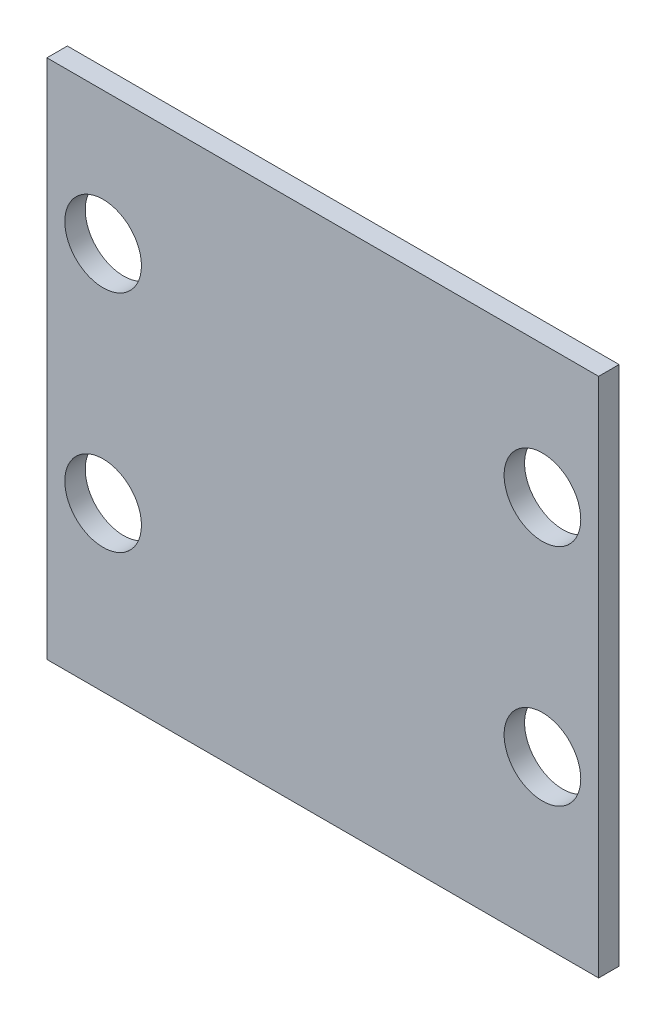
from build123d import *

# Parameters (mm, degrees)
CROQUIS1_W              = 54
CROQUIS1_H              = 51
CROQUIS1_R              = 3.75
SALIENTE_EXTRUIR1_DEPTH = 2


with BuildPart() as part:
    # Croquis1 → Saliente-Extruir1 (new body)
    with BuildSketch(Plane.XY):
        Rectangle(CROQUIS1_W, CROQUIS1_H)
        with Locations((-21.5, 12.5)):
            Circle(CROQUIS1_R, mode=Mode.SUBTRACT)
        with Locations((21.5, 12.5)):
            Circle(CROQUIS1_R, mode=Mode.SUBTRACT)
        with Locations((21.5, -9.5)):
            Circle(CROQUIS1_R, mode=Mode.SUBTRACT)
        with Locations((-21.5, -9.5)):
            Circle(CROQUIS1_R, mode=Mode.SUBTRACT)
    extrude(amount=-SALIENTE_EXTRUIR1_DEPTH)


solid = part.part
